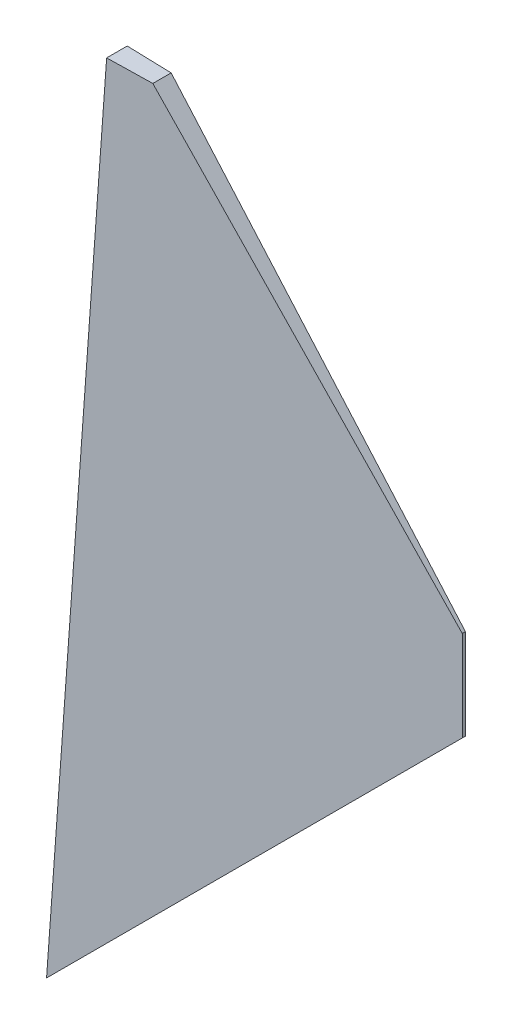
from build123d import *

# Parameters (mm, degrees)
BOSS_EXTRUDE1_DEPTH     = 508
CUT_EXTRUDE3_DEPTH      = 558.14262793
CUT_EXTRUDE3_DEPTH_BACK = 558.14262793


with BuildPart() as part:
    # Sketch1 → Boss-Extrude1 (new body)
    with BuildSketch(Plane(origin=(0, 0, 0), x_dir=(1, 0, 0), z_dir=(0, 1, 0))):
        Polygon((0, -3.937193282), (0, 9.270806718), (228.6, 2.666806718), (228.6, 0.888806718), align=None)
    extrude(amount=BOSS_EXTRUDE1_DEPTH)

    # Sketch3 → Cut-Extrude3 (cut, two sides: drawn at the far end of the back side and taken through both)
    with BuildSketch(Plane.XY.offset(-CUT_EXTRUDE3_DEPTH_BACK)):
        Polygon((228.6, 0), (0, 0), (151.300007346, 151.300007346), (228.6, 228.6), align=None)
        Polygon((228.6, 508), (228.6, 279.4), (58.436980759, 463.596176947), (33.036980759, 463.596176947), (0, 0), (0, 508), align=None)
    extrude(amount=CUT_EXTRUDE3_DEPTH + CUT_EXTRUDE3_DEPTH_BACK, mode=Mode.SUBTRACT)


solid = part.part
